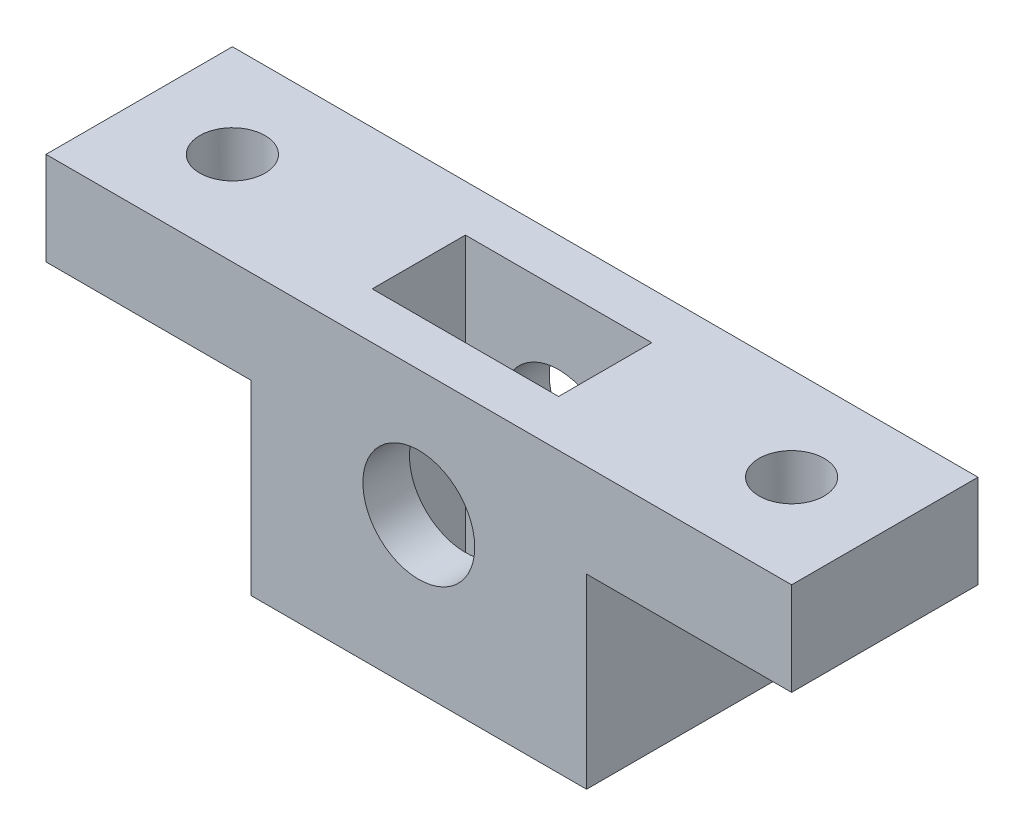
from build123d import *

# Parameters (mm, degrees)
ESBO_O1_R                = 3
RESSALTO_EXTRUS_O1_DEPTH = 10
ESBO_O2_R                = 1.75
CORTE_EXTRUS_O1_DEPTH    = 10
ESBO_O3_W                = 10
ESBO_O3_H                = 5
CORTE_EXTRUS_O2_DEPTH    = 20


with BuildPart() as part:
    # Esboço1 → Ressalto-extrusão1 (new body)
    with BuildSketch(Plane.XY):
        Polygon((-9, -5), (-9, -15), (9, -15), (9, -5), (20, -5), (20, 0), (-20, 0), (-20, -5), align=None)
        with Locations((0, -6.75)):
            Circle(ESBO_O1_R, mode=Mode.SUBTRACT)
    extrude(amount=RESSALTO_EXTRUS_O1_DEPTH)

    # Esboço2 → Corte-extrusão1 (cut)
    with BuildSketch(Plane(origin=(0, 0, 0), x_dir=(1, 0, 0), z_dir=(0, 1, 0))):
        with Locations(Location((-15, -5, 0), (0, 0, 180))):
            Circle(ESBO_O2_R)
        with Locations(Location((15, -5, 0), (0, 0, 180))):
            Circle(ESBO_O2_R)
    extrude(amount=-CORTE_EXTRUS_O1_DEPTH, mode=Mode.SUBTRACT)

    # Esboço3 → Corte-extrusão2 (cut)
    with BuildSketch(Plane.XZ.offset(15)):
        with Locations((0, 5)):
            Rectangle(ESBO_O3_W, ESBO_O3_H)
    extrude(amount=-CORTE_EXTRUS_O2_DEPTH, mode=Mode.SUBTRACT)


solid = part.part
